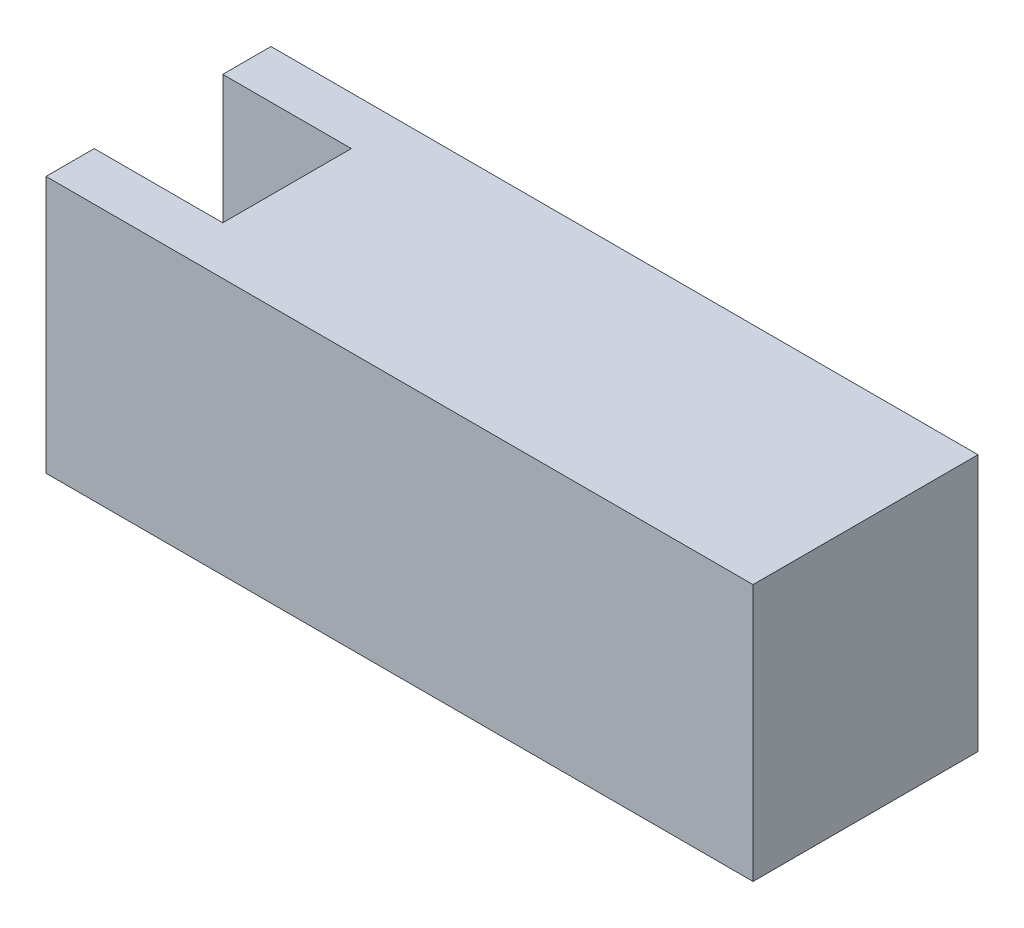
from build123d import *

# Parameters (mm, degrees)
SKETCH1_W           = 13.97
SKETCH1_H           = 5.08
BOSS_EXTRUDE1_DEPTH = 4.445
SKETCH2_W           = 2.54
SKETCH2_H           = 5.08
CUT_EXTRUDE1_DEPTH  = 2.54


with BuildPart() as part:
    # Sketch1 → Boss-Extrude1 (new body)
    with BuildSketch(Plane.XY):
        with Locations((-6.985, 2.54)):
            Rectangle(SKETCH1_W, SKETCH1_H)
    extrude(amount=BOSS_EXTRUDE1_DEPTH)

    # Sketch2 → Cut-Extrude1 (cut)
    with BuildSketch(Plane.ZY.offset(13.97)):
        with Locations((2.2225, 2.54)):
            Rectangle(SKETCH2_W, SKETCH2_H)
    extrude(amount=-CUT_EXTRUDE1_DEPTH, mode=Mode.SUBTRACT)


solid = part.part
